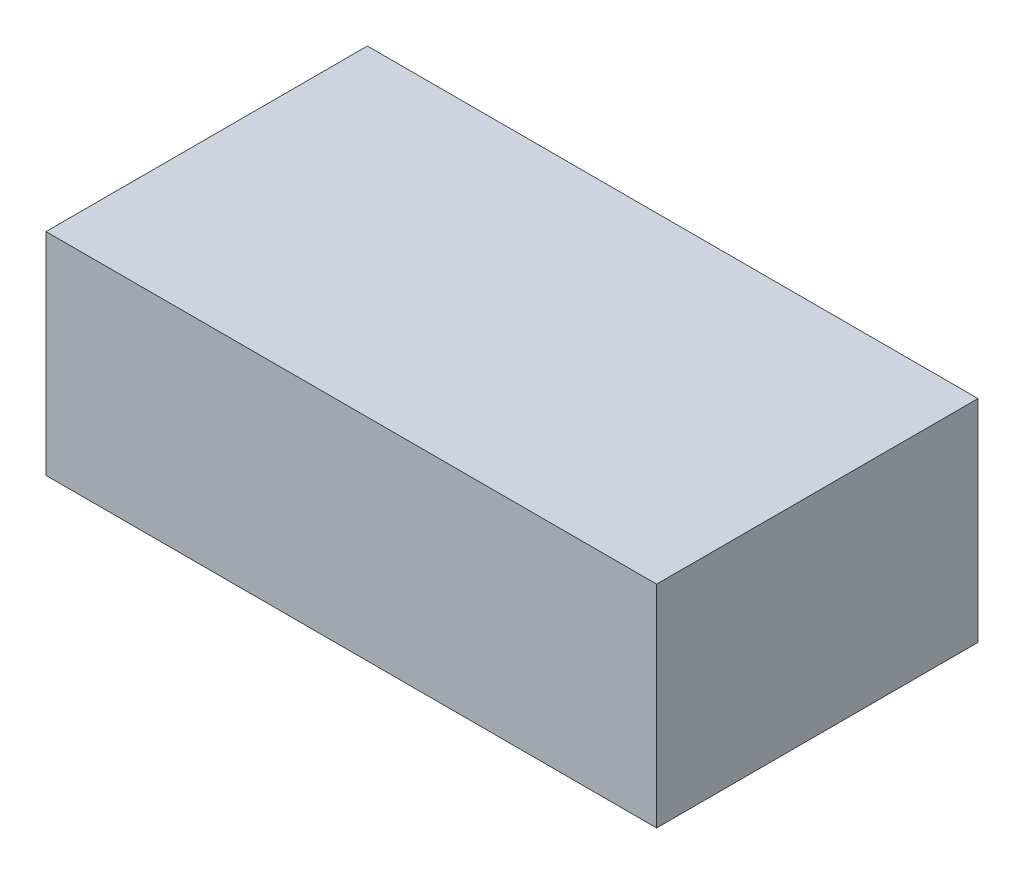
from build123d import *

# Parameters (mm, degrees)
SKETCH1_W           = 66.5
SKETCH1_H           = 35
BOSS_EXTRUDE1_DEPTH = 23


with BuildPart() as part:
    # Sketch1 → Boss-Extrude1 (new body)
    with BuildSketch(Plane(origin=(0, 0, 0), x_dir=(1, 0, 0), z_dir=(0, 1, 0))):
        Rectangle(SKETCH1_W, SKETCH1_H)
    extrude(amount=BOSS_EXTRUDE1_DEPTH)


solid = part.part
